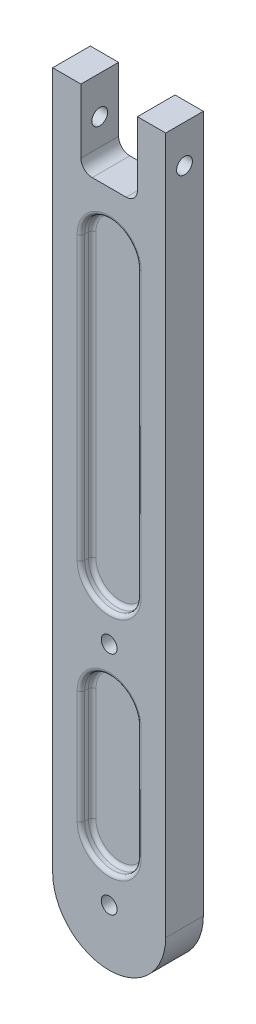
from build123d import *

# Parameters (mm, degrees)
SKETCH_1_W               = 30
SKETCH_1_H               = 200
EXTRUDE_1_DEPTH          = 10
FILLET_1_RADIUS          = 15
FILLET_1_LENGTH          = 10
SKETCH_2_R               = 2.1
CUT_EXTRUDE_1_DEPTH      = 10
SKETCH_3_R               = 2.1
CUT_EXTRUDE_2_DEPTH      = 10
SKETCH_4_W               = 15
SKETCH_4_H               = 20
CUT_EXTRUDE_3_DEPTH      = 10
FILLET_4_R               = 3
CUT_EXTRUDE_5_DEPTH      = 203.484567313
CUT_EXTRUDE_5_DEPTH_BACK = 203.484567313
SKETCH_6_R               = 2.1
CUT_EXTRUDE_6_DEPTH      = 3
FILLET_5_R               = 1
CUT_EXTRUDE_START        = -3
CUT_EXTRUDE_7_DEPTH      = 3
FILLET_6_R               = 1


with BuildPart() as part:
    # 草图1 → 凸台-拉伸1 (new body)
    with BuildSketch(Plane.XY):
        with Locations((15, 100)):
            Rectangle(SKETCH_1_W, SKETCH_1_H)
    extrude(amount=EXTRUDE_1_DEPTH)

    # 圆角1: full round fillet: the end face becomes a half cylinder, R = half its width
    fillet_1_face = Plane((15, 0, 5), x_dir=(0, 0, 1), z_dir=(0, -1, 0))  # on the end face: x along it, z out of the body
    fillet_1_slab = fillet_1_face.offset(-FILLET_1_RADIUS / 2) * Box(FILLET_1_LENGTH, 2 * FILLET_1_RADIUS, FILLET_1_RADIUS, mode=Mode.PRIVATE)  # the body's end, R deep
    fillet_1_round = Plane((15, 15, 5), x_dir=(0, -1, 0), z_dir=(0, 0, 1)) * Cylinder(FILLET_1_RADIUS, FILLET_1_LENGTH, mode=Mode.PRIVATE)  # its axis R under the face
    add(fillet_1_slab - fillet_1_round, mode=Mode.SUBTRACT)

    # 草图2 → 切除-拉伸1 (cut)
    with BuildSketch(Plane.XY.offset(10)):
        with Locations((15, 15)):
            Circle(SKETCH_2_R)
    extrude(amount=-CUT_EXTRUDE_1_DEPTH, mode=Mode.SUBTRACT)

    # 草图3 → 切除-拉伸2 (cut)
    with BuildSketch(Plane.XY.offset(10)):
        with Locations((15, 75)):
            Circle(SKETCH_3_R)
    extrude(amount=-CUT_EXTRUDE_2_DEPTH, mode=Mode.SUBTRACT)

    # 草图4 → 切除-拉伸3 (cut)
    with BuildSketch(Plane.XY.offset(10)):
        with Locations((15, 190)):
            Rectangle(SKETCH_4_W, SKETCH_4_H)
    extrude(amount=-CUT_EXTRUDE_3_DEPTH, mode=Mode.SUBTRACT)

    # 圆角4
    fillet_4_edges = [part.edges().sort_by_distance(p)[0] for p in [
        (7.5, 180, 5),
        (22.5, 180, 5),
    ]]
    fillet(fillet_4_edges, radius=FILLET_4_R)

    # 草图6 → 切除-拉伸5 (cut, two sides: drawn at the far end of the back side and taken through both)
    with BuildSketch(Plane(origin=(30, 0, 0), x_dir=(0, 0, -1), z_dir=(1, 0, 0)).offset(-CUT_EXTRUDE_5_DEPTH_BACK)):
        with Locations(Location((-5, 190, 0), (0, 0, 90))):
            Circle(SKETCH_6_R)
    extrude(amount=CUT_EXTRUDE_5_DEPTH + CUT_EXTRUDE_5_DEPTH_BACK, mode=Mode.SUBTRACT)

    # 草图7 → 切除-拉伸6 (cut)
    with BuildSketch(Plane(origin=(0, 0, 0), x_dir=(-1, 0, 0), z_dir=(0, 0, -1))):
        with BuildLine():
            Line((-7.5, 165), (-7.5, 90))
            ThreePointArc((-7.5, 90), (-15, 82.5), (-22.5, 90))
            Line((-22.5, 90), (-22.5, 165))
            ThreePointArc((-22.5, 165), (-15, 172.5), (-7.5, 165))
        make_face()
        with BuildLine():
            Line((-7.5, 60), (-7.5, 30))
            ThreePointArc((-7.5, 30), (-15, 22.5), (-22.5, 30))
            Line((-22.5, 30), (-22.5, 60))
            ThreePointArc((-22.5, 60), (-15, 67.5), (-7.5, 60))
        make_face()
    extrude(amount=-CUT_EXTRUDE_6_DEPTH, mode=Mode.SUBTRACT)

    # 圆角5
    fillet_5_edges = [part.edges().sort_by_distance(p)[0] for p in [
        (15, 172.5, 3),
        (7.5, 127.5, 3),
        (15, 82.5, 3),
        (22.5, 127.5, 3),
        (15, 172.5, 0),
        (22.5, 127.5, 0),
        (15, 82.5, 0),
        (7.5, 127.5, 0),
        (15, 67.5, 3),
        (7.5, 45, 3),
        (15, 22.5, 3),
        (22.5, 45, 3),
        (15, 67.5, 0),
        (22.5, 45, 0),
        (15, 22.5, 0),
        (7.5, 45, 0),
    ]]
    fillet(fillet_5_edges, radius=FILLET_5_R)

    # 草图8 → 切除-拉伸7 (cut)
    with BuildSketch(Plane.XY.offset(10).offset(CUT_EXTRUDE_START)):
        with BuildLine():
            Line((22.5, 165), (22.5, 90))
            ThreePointArc((22.5, 90), (15, 82.5), (7.5, 90))
            Line((7.5, 90), (7.5, 165))
            ThreePointArc((7.5, 165), (15, 172.5), (22.5, 165))
        make_face()
        with BuildLine():
            Line((22.5, 60), (22.5, 30))
            ThreePointArc((22.5, 30), (15, 22.5), (7.5, 30))
            Line((7.5, 30), (7.5, 60))
            ThreePointArc((7.5, 60), (15, 67.5), (22.5, 60))
        make_face()
    extrude(amount=CUT_EXTRUDE_7_DEPTH, mode=Mode.SUBTRACT)

    # 圆角6
    fillet_6_edges = [part.edges().sort_by_distance(p)[0] for p in [
        (15, 172.5, 7),
        (22.5, 127.5, 7),
        (15, 82.5, 7),
        (7.5, 127.5, 7),
        (15, 172.5, 10),
        (7.5, 127.5, 10),
        (15, 82.5, 10),
        (22.5, 127.5, 10),
        (15, 67.5, 7),
        (22.5, 45, 7),
        (15, 22.5, 7),
        (7.5, 45, 7),
        (15, 67.5, 10),
        (7.5, 45, 10),
        (15, 22.5, 10),
        (22.5, 45, 10),
    ]]
    fillet(fillet_6_edges, radius=FILLET_6_R)


solid = part.part
